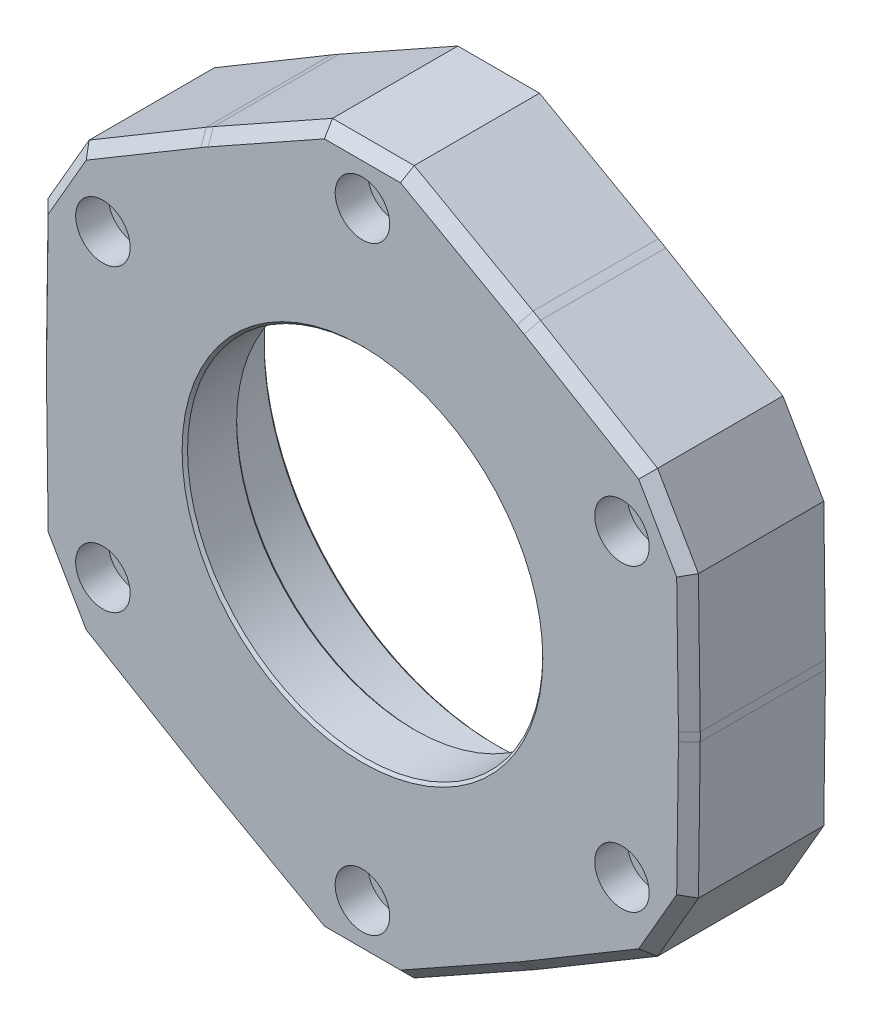
from build123d import *

# Parameters (mm, degrees)
SKETCH1_R           = 60
SKETCH1_R_2         = 2.55
SKETCH1_R_3         = 42.55
BOSS_EXTRUDE1_DEPTH = 25
BOSS_EXTRUDE2_START = -10
SKETCH3_R           = 42.55
SKETCH3_R_2         = 32.6
BOSS_EXTRUDE2_DEPTH = 10
BOSS_EXTRUDE3_DEPTH = 25
SKETCH8_R           = 5
CUT_EXTRUDE1_DEPTH  = 6
CHAMFER2_SIZE       = 0.5
CHAMFER3_SIZE       = 2
SKETCH9_R           = 2.025
CUT_EXTRUDE2_DEPTH  = 7


with BuildPart() as part:
    # Sketch1 → Boss-Extrude1 (new body)
    with BuildSketch(Plane.XY):
        Circle(SKETCH1_R)
        with Locations((0, 55)):
            Circle(SKETCH1_R_2, mode=Mode.SUBTRACT)
        with Locations((47.631397208, 27.5)):
            Circle(SKETCH1_R_2, mode=Mode.SUBTRACT)
        with Locations((47.631397208, -27.5)):
            Circle(SKETCH1_R_2, mode=Mode.SUBTRACT)
        with Locations((0, -55)):
            Circle(SKETCH1_R_2, mode=Mode.SUBTRACT)
        with Locations((-47.631397208, -27.5)):
            Circle(SKETCH1_R_2, mode=Mode.SUBTRACT)
        with Locations((-47.631397208, 27.5)):
            Circle(SKETCH1_R_2, mode=Mode.SUBTRACT)
        Circle(SKETCH1_R_3, mode=Mode.SUBTRACT)
    extrude(amount=BOSS_EXTRUDE1_DEPTH)

    # Sketch3 → Boss-Extrude2 (add)
    with BuildSketch(Plane.XY.offset(25).offset(BOSS_EXTRUDE2_START)):
        Circle(SKETCH3_R)
        Circle(SKETCH3_R_2, mode=Mode.SUBTRACT)
    extrude(amount=BOSS_EXTRUDE2_DEPTH)

    # Sketch7 → Boss-Extrude3 (add)
    with BuildSketch(Plane(origin=(0, 0, 0), x_dir=(-1, 0, 0), z_dir=(0, 0, -1))):
        with BuildLine():
            Line((-29.313322314, 52.351973553), (-7.5, 64.565857851))
            Line((-7.5, 64.565857851), (7.5, 64.565857851))
            Line((7.5, 64.565857851), (29.313322314, 52.351973553))
            ThreePointArc((29.313322314, 52.351973553), (0, 60), (-29.313322314, 52.351973553))
        make_face()
        with BuildLine():
            Line((59.665673116, 25.787738397), (59.994800192, 0.789904984))
            ThreePointArc((59.994800192, 0.789904984), (51.961524227, 30), (30.681477878, 51.56206857))
            Line((30.681477878, 51.56206857), (52.165673116, 38.778119454))
            Line((52.165673116, 38.778119454), (59.665673116, 25.787738397))
        make_face()
        with BuildLine():
            Line((52.165673116, -38.778119454), (30.681477878, -51.56206857))
            ThreePointArc((30.681477878, -51.56206857), (51.961524227, -30), (59.994800192, -0.789904984))
            Line((59.994800192, -0.789904984), (59.665673116, -25.787738397))
            Line((59.665673116, -25.787738397), (52.165673116, -38.778119454))
        make_face()
        with BuildLine():
            Line((-7.5, -64.565857851), (-29.313322314, -52.351973553))
            ThreePointArc((-29.313322314, -52.351973553), (0, -60), (29.313322314, -52.351973553))
            Line((29.313322314, -52.351973553), (7.5, -64.565857851))
            Line((7.5, -64.565857851), (-7.5, -64.565857851))
        make_face()
        with BuildLine():
            Line((-59.665673116, -25.787738397), (-59.994800192, -0.789904984))
            ThreePointArc((-59.994800192, -0.789904984), (-51.961524227, -30), (-30.681477878, -51.56206857))
            Line((-30.681477878, -51.56206857), (-52.165673116, -38.778119454))
            Line((-52.165673116, -38.778119454), (-59.665673116, -25.787738397))
        make_face()
        with BuildLine():
            Line((-52.165673116, 38.778119454), (-30.681477878, 51.56206857))
            ThreePointArc((-30.681477878, 51.56206857), (-51.961524227, 30), (-59.994800192, 0.789904984))
            Line((-59.994800192, 0.789904984), (-59.665673116, 25.787738397))
            Line((-59.665673116, 25.787738397), (-52.165673116, 38.778119454))
        make_face()
    extrude(amount=-BOSS_EXTRUDE3_DEPTH)

    # Sketch8 → Cut-Extrude1 (cut)
    with BuildSketch(Plane.XY.offset(25)):
        with Locations((0, 55)):
            Circle(SKETCH8_R)
        with Locations((47.631397208, 27.5)):
            Circle(SKETCH8_R)
        with Locations((47.631397208, -27.5)):
            Circle(SKETCH8_R)
        with Locations((0, -55)):
            Circle(SKETCH8_R)
        with Locations((-47.631397208, -27.5)):
            Circle(SKETCH8_R)
        with Locations((-47.631397208, 27.5)):
            Circle(SKETCH8_R)
    extrude(amount=-CUT_EXTRUDE1_DEPTH, mode=Mode.SUBTRACT)

    # Chamfer2
    chamfer2_edges = [part.edges().sort_by_distance(p)[0] for p in [
        (-32.6, 0, 15),
        (-32.6, 0, 25),
        (-42.55, 0, 0),
    ]]
    chamfer(chamfer2_edges, length=CHAMFER2_SIZE)

    # Chamfer3
    chamfer3_edges = [part.edges().sort_by_distance(p)[0] for p in [
        (-30, 51.961524227, 25),
        (-18.406661157, 58.458915702, 25),
        (0, 64.565857851, 25),
        (18.406661157, 58.458915702, 25),
        (-60, 0, 25),
        (-59.830236654, 13.28882169, 25),
        (-55.915673116, 32.282928925, 25),
        (-41.423575497, 45.170094012, 25),
        (-30, -51.961524227, 25),
        (-41.423575497, -45.170094012, 25),
        (-55.915673116, -32.282928925, 25),
        (-59.830236654, -13.28882169, 25),
        (30, -51.961524227, 25),
        (18.406661157, -58.458915702, 25),
        (0, -64.565857851, 25),
        (-18.406661157, -58.458915702, 25),
        (60, 0, 25),
        (59.830236654, -13.28882169, 25),
        (55.915673116, -32.282928925, 25),
        (41.423575497, -45.170094012, 25),
        (30, 51.961524227, 25),
        (41.423575497, 45.170094012, 25),
        (55.915673116, 32.282928925, 25),
        (59.830236654, 13.28882169, 25),
    ]]
    chamfer(chamfer3_edges, length=CHAMFER3_SIZE)

    # Sketch9 → Cut-Extrude2 (cut)
    with BuildSketch(Plane(origin=(0, 0, 0), x_dir=(-1, 0, 0), z_dir=(0, 0, -1))):
        with Locations((-8.328166601, 47.231379834)):
            Circle(SKETCH9_R)
        with Locations((8.328166601, 47.231379834)):
            Circle(SKETCH9_R)
        with Locations((23.98, 41.534578366)):
            Circle(SKETCH9_R)
        with Locations((36.739491492, 30.828093761)):
            Circle(SKETCH9_R)
        with Locations((45.067658093, 16.403286074)):
            Circle(SKETCH9_R)
        with Locations((47.96, 0)):
            Circle(SKETCH9_R)
        with Locations((45.067658093, -16.403286074)):
            Circle(SKETCH9_R)
        with Locations((36.739491492, -30.828093761)):
            Circle(SKETCH9_R)
        with Locations((23.98, -41.534578366)):
            Circle(SKETCH9_R)
        with Locations((8.328166601, -47.231379834)):
            Circle(SKETCH9_R)
        with Locations((-8.328166601, -47.231379834)):
            Circle(SKETCH9_R)
        with Locations((-23.98, -41.534578366)):
            Circle(SKETCH9_R)
        with Locations((-36.739491492, -30.828093761)):
            Circle(SKETCH9_R)
        with Locations((-45.067658093, -16.403286074)):
            Circle(SKETCH9_R)
        with Locations((-47.96, 0)):
            Circle(SKETCH9_R)
        with Locations((-45.067658093, 16.403286074)):
            Circle(SKETCH9_R)
        with Locations((-36.739491492, 30.828093761)):
            Circle(SKETCH9_R)
        with Locations((-23.98, 41.534578366)):
            Circle(SKETCH9_R)
    extrude(amount=-CUT_EXTRUDE2_DEPTH, mode=Mode.SUBTRACT)


solid = part.part
